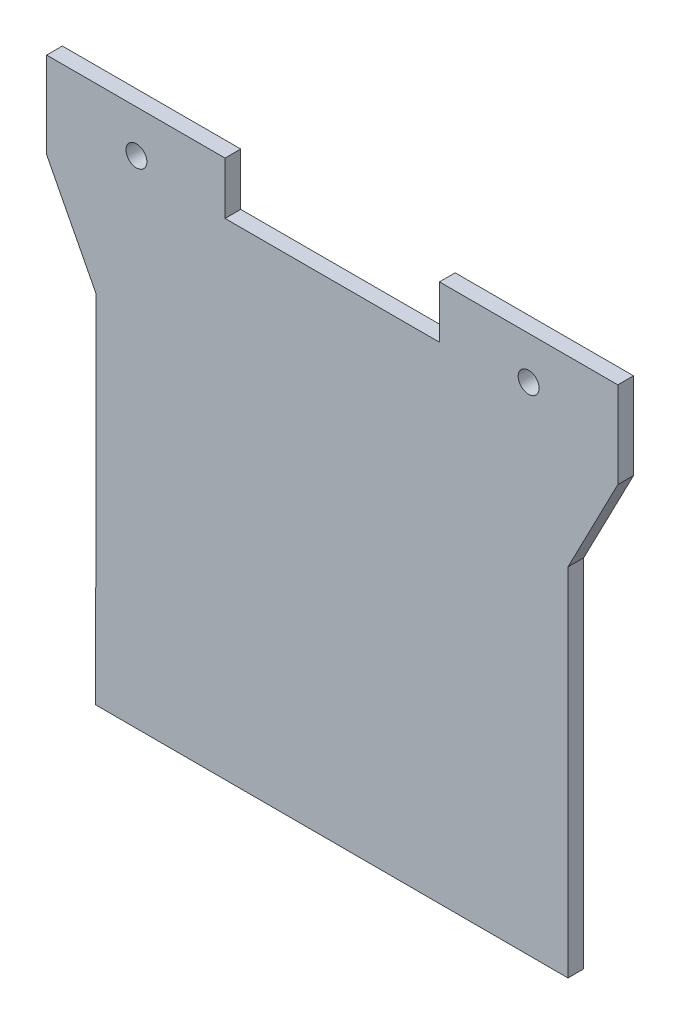
from build123d import *

# Parameters (mm, degrees)
SKETCH1_R           = 2
BOSS_EXTRUDE1_DEPTH = 3


with BuildPart() as part:
    # Sketch1 → Boss-Extrude1 (new body)
    with BuildSketch(Plane.XY):
        Polygon((-17.171078522, 8.102088167), (16.942973826, 8.102088167), (16.942973826, -1.897911833), (57.947591884, -1.897911833), (57.947591884, 8.102088167), (92.052408116, 8.102088167), (92.052408116, -8.436191264), (82.530366353, -26.812061334), (82.530366353, -94.896180398), (-7.810969029, -94.825139281), (-7.70389138, -26.741104419), (-17.197021163, -8.350281515), align=None)
        Circle(SKETCH1_R, mode=Mode.SUBTRACT)
        with Locations((75, 0)):
            Circle(SKETCH1_R, mode=Mode.SUBTRACT)
    extrude(amount=BOSS_EXTRUDE1_DEPTH)


solid = part.part
